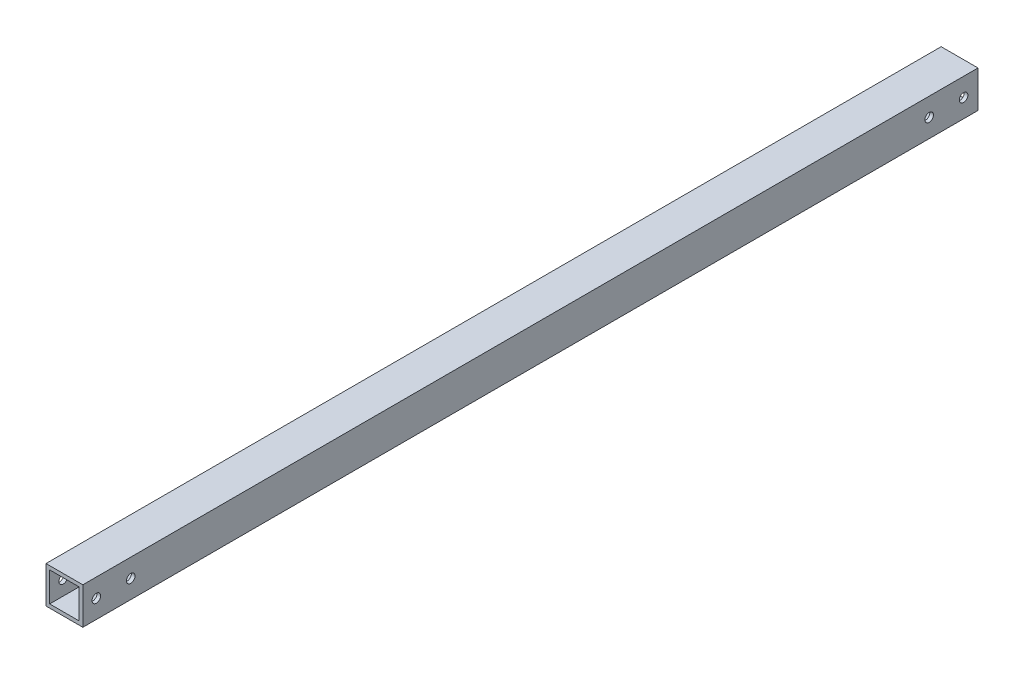
from build123d import *

# Parameters (mm, degrees)
SKETCH_1_W             = 30
SKETCH_1_H             = 30
SKETCH_1_W_2           = 24
SKETCH_1_H_2           = 24
EXTRUDE_1_DEPTH        = 729
HOLE_WIZARD_7_0_7_1_D  = 7
PATTERN_LINEAR_1_COUNT = 2
PATTERN_LINEAR_1_PITCH = 678.25


with BuildPart() as part:
    # 草图1 → 拉伸1 (new body)
    with BuildSketch(Plane.XY):
        with Locations((15, -15)):
            Rectangle(SKETCH_1_W, SKETCH_1_H)
        with Locations((15, -15)):
            Rectangle(SKETCH_1_W_2, SKETCH_1_H_2, mode=Mode.SUBTRACT)
    extrude(amount=EXTRUDE_1_DEPTH)

    # Ø7.0 (7) 直径孔1 (through all)
    with Locations(Plane(origin=(30, 0, 0), x_dir=(0, 0, -1), z_dir=(1, 0, 0))):
        with Locations((-718, -15), (-690, -15)):
            hole_wizard_7_0_7_1 = Hole(HOLE_WIZARD_7_0_7_1_D / 2)

    # 阵列(线性)1: Ø7.0 (7) 直径孔1 ×2
    with Locations(*[(0, 0, -i * PATTERN_LINEAR_1_PITCH) for i in range(1, PATTERN_LINEAR_1_COUNT)]):
        add(hole_wizard_7_0_7_1, mode=Mode.SUBTRACT)


solid = part.part
